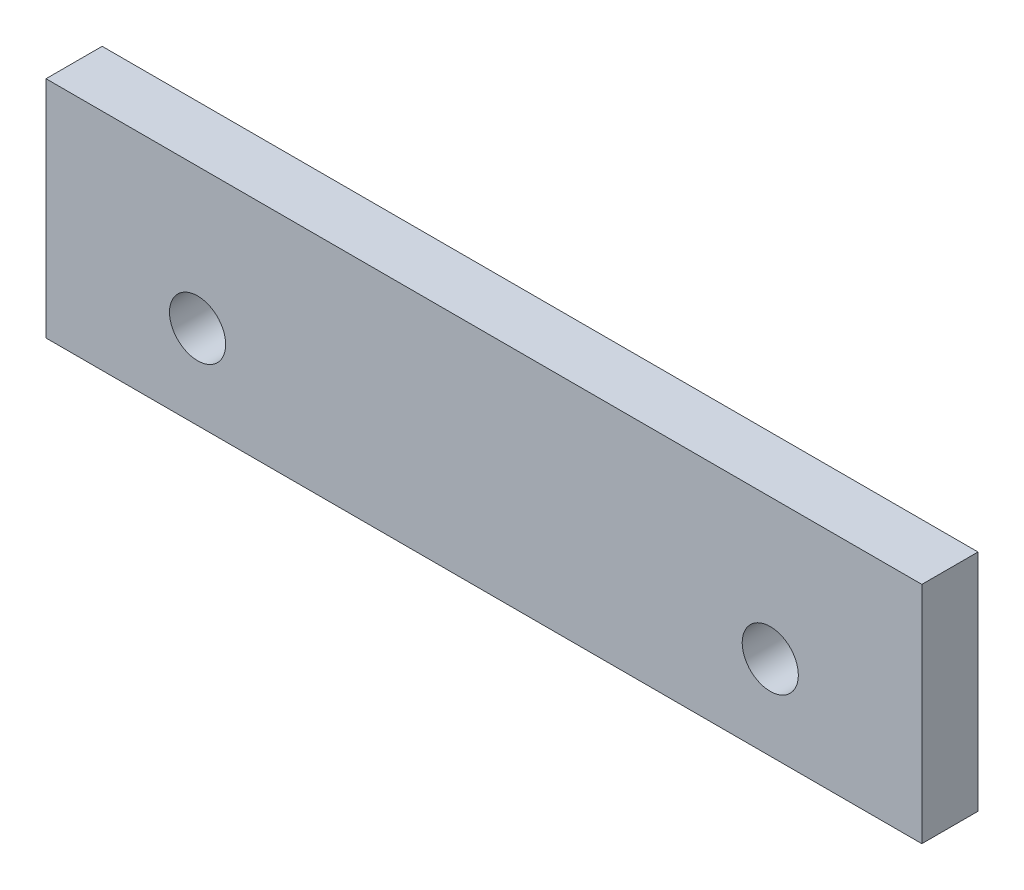
from build123d import *

# Parameters (mm, degrees)
SKETCH1_W           = 78
SKETCH1_H           = 20
BOSS_EXTRUDE1_DEPTH = 5
SKETCH3_R           = 2.5
CUT_EXTRUDE1_DEPTH  = 10


with BuildPart() as part:
    # Sketch1 → Boss-Extrude1 (new body)
    with BuildSketch(Plane.XY):
        Rectangle(SKETCH1_W, SKETCH1_H)
    extrude(amount=BOSS_EXTRUDE1_DEPTH)

    # Sketch3 → Cut-Extrude1 (cut)
    with BuildSketch(Plane(origin=(0, 0, 0), x_dir=(-1, 0, 0), z_dir=(0, 0, -1))):
        with Locations((-25.5, -2.5)):
            Circle(SKETCH3_R)
        with Locations((25.5, -2.5)):
            Circle(SKETCH3_R)
    extrude(amount=-CUT_EXTRUDE1_DEPTH, mode=Mode.SUBTRACT)


solid = part.part
